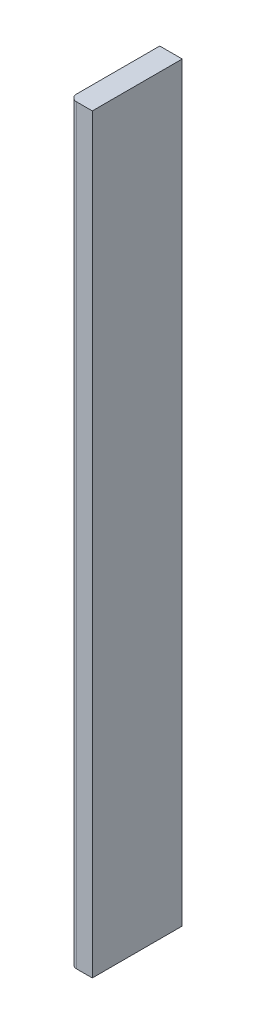
from build123d import *

# Parameters (mm, degrees)
SKETCH_1_W      = 4
SKETCH_1_H      = 33.4
EXTRUDE_1_DEPTH = 1
FILLET_1_R      = 0.3


with BuildPart() as part:
    # Эскиз1 → Бобышка-Вытянуть1 (new body)
    with BuildSketch(Plane.ZY.offset(0.1)):
        with Locations((2, 0)):
            Rectangle(SKETCH_1_W, SKETCH_1_H)
    extrude(amount=EXTRUDE_1_DEPTH)

    # Скругление1
    fillet_1_edges = [part.edges().sort_by_distance(p)[0] for p in [
        (-1.1, 0, 4),
    ]]
    fillet(fillet_1_edges, radius=FILLET_1_R)


solid = part.part
